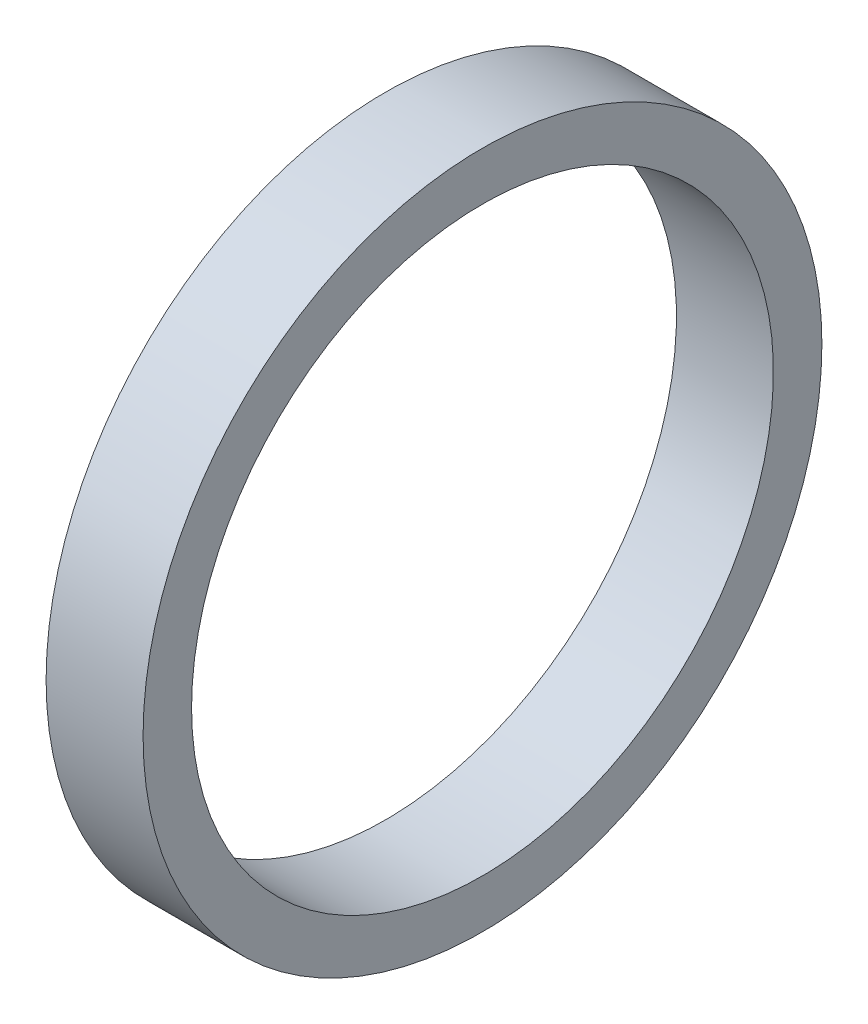
from build123d import *

# Parameters (mm, degrees)
SKETCH1_W = 2
SKETCH1_H = 1


with BuildPart() as part:
    # Sketch1 → Revolve1 (revolve)
    with BuildSketch(Plane.XY, mode=Mode.PRIVATE) as revolve1_sk:
        with Locations((1, 6.5)):
            Rectangle(SKETCH1_W, SKETCH1_H)
    revolve(revolve1_sk.sketch.rotate(Axis((0, 0, 0), (1, 0, 0)), 90), axis=Axis((0, 0, 0), (1, 0, 0)))


solid = part.part
